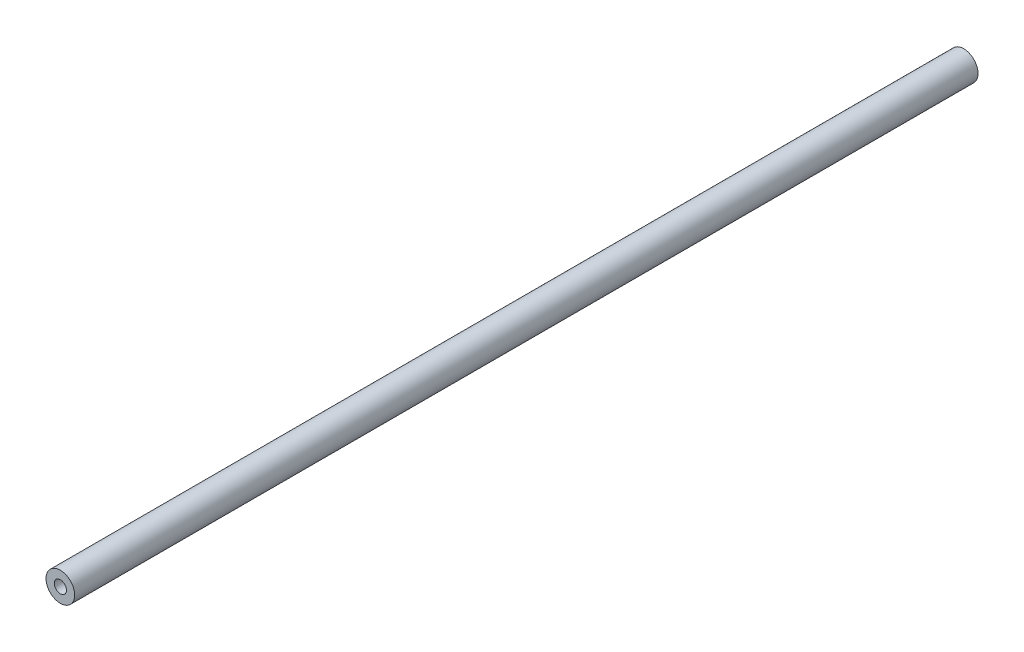
from build123d import *

# Parameters (mm, degrees)
SKETCH1_R                            = 4.7625
BOSS_EXTRUDE1_DEPTH                  = 150.01875
F_10_32_TAPPED_HOLE1_D               = 4.0386
F_10_32_TAPPED_HOLE1_DEPTH           = 11.938
F_10_32_TAPPED_HOLE1_TIP             = 1.213317848
F_10_32_TAPPED_HOLE1_ON_FACE_2_D     = 4.0386
F_10_32_TAPPED_HOLE1_ON_FACE_2_DEPTH = 11.938
F_10_32_TAPPED_HOLE1_ON_FACE_2_TIP   = 1.213317848


with BuildPart() as part:
    # Sketch1 → Boss-Extrude1 (new, symmetric)
    with BuildSketch(Plane.XY):
        with Locations(Location((0, 0, 0), (0, 0, 180))):
            Circle(SKETCH1_R)
    extrude(amount=BOSS_EXTRUDE1_DEPTH, both=True)

    # #10-32 Tapped Hole1
    with Locations(Plane.XY.offset(150.01875)):
        with Locations((0, 0)):
            Hole(F_10_32_TAPPED_HOLE1_D / 2, depth=F_10_32_TAPPED_HOLE1_DEPTH)
            with Locations((0, 0, -(F_10_32_TAPPED_HOLE1_DEPTH + F_10_32_TAPPED_HOLE1_TIP / 2))):  # 118° drill point
                Cone(0, F_10_32_TAPPED_HOLE1_D / 2, F_10_32_TAPPED_HOLE1_TIP, mode=Mode.SUBTRACT)

    # #10-32 Tapped Hole1 on face 2
    with Locations(Plane(origin=(0, 0, -150.01875), x_dir=(-1, 0, 0), z_dir=(0, 0, -1))):
        with Locations((0, 0)):
            Hole(F_10_32_TAPPED_HOLE1_ON_FACE_2_D / 2, depth=F_10_32_TAPPED_HOLE1_ON_FACE_2_DEPTH)
            with Locations((0, 0, -(F_10_32_TAPPED_HOLE1_ON_FACE_2_DEPTH + F_10_32_TAPPED_HOLE1_ON_FACE_2_TIP / 2))):  # 118° drill point
                Cone(0, F_10_32_TAPPED_HOLE1_ON_FACE_2_D / 2, F_10_32_TAPPED_HOLE1_ON_FACE_2_TIP, mode=Mode.SUBTRACT)


solid = part.part
